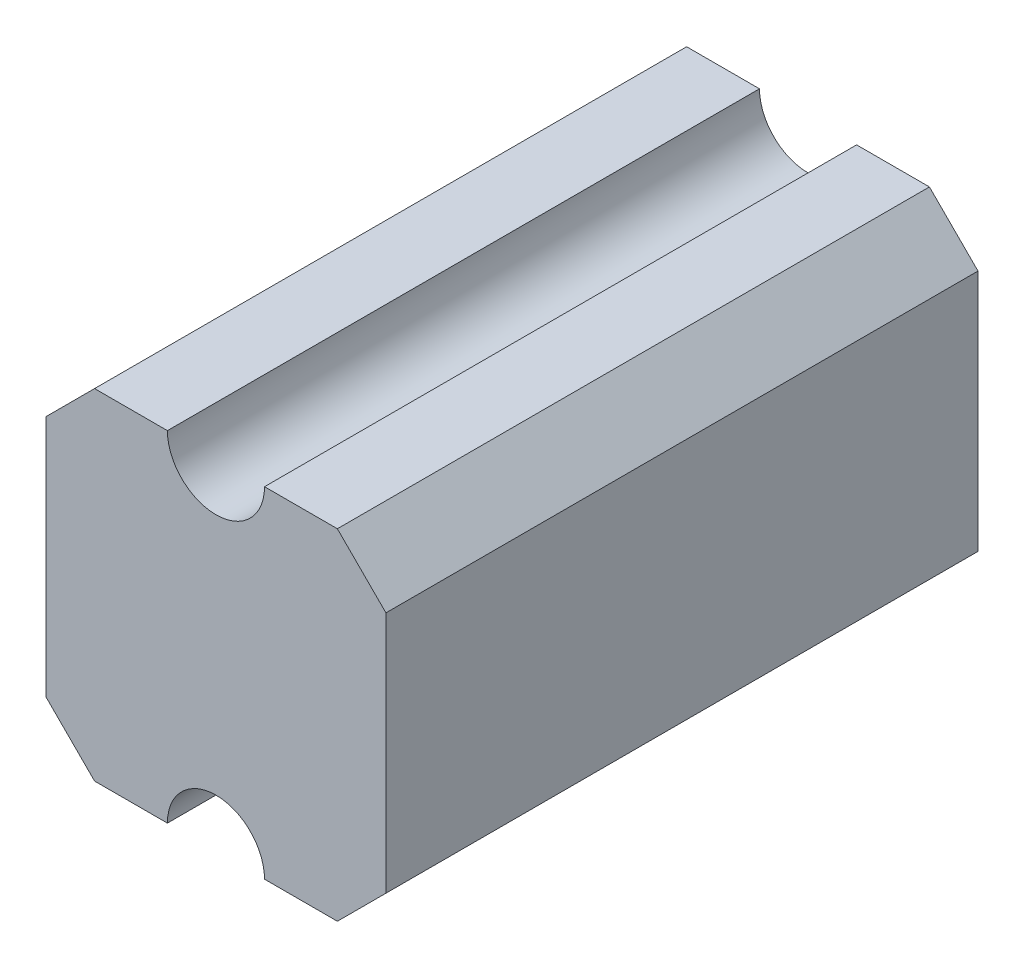
from build123d import *

# Parameters (mm, degrees)
COCKPIT_TEMPLATE_DEPTH = 304.8


with BuildPart() as part:
    # Sketch11 → Cockpit Template (new, symmetric)
    with BuildSketch(Plane.XY.offset(1043.931203382)):
        with BuildLine():
            Line((125, 468.656673601), (50, 468.656673601))
            ThreePointArc((50, 468.656673601), (0, 418.656673601), (-50, 468.656673601))
            Line((-50, 468.656673601), (-125, 468.656673601))
            Line((-125, 468.656673601), (-175, 418.656673601))
            Line((-175, 418.656673601), (-175, 168.656673601))
            Line((-175, 168.656673601), (-125, 118.656673601))
            Line((-125, 118.656673601), (-50, 118.656673601))
            ThreePointArc((-50, 118.656673601), (0, 168.656673601), (50, 118.656673601))
            Line((50, 118.656673601), (125, 118.656673601))
            Line((125, 118.656673601), (175, 168.656673601))
            Line((175, 168.656673601), (175, 418.656673601))
            Line((175, 418.656673601), (125, 468.656673601))
        make_face()
    extrude(amount=COCKPIT_TEMPLATE_DEPTH, both=True)


solid = part.part
